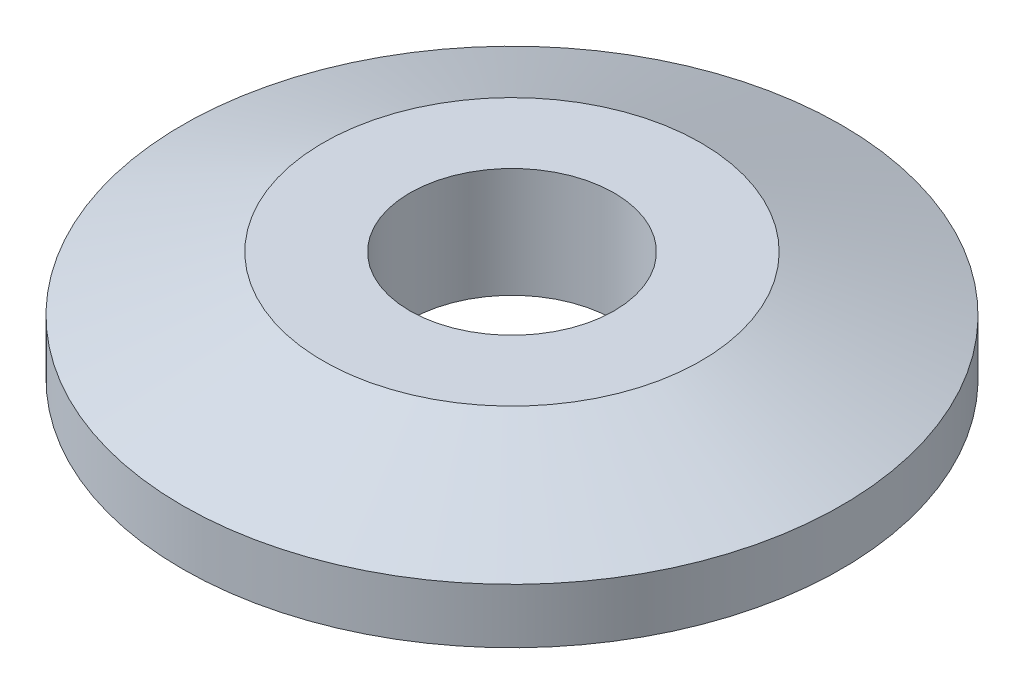
from build123d import *

# Parameters (mm, degrees)
SKETCH1_R           = 15
BOSS_EXTRUDE1_DEPTH = 5
SKETCH2_R           = 8.6
CUT_EXTRUDE1_DEPTH  = 2.5
SKETCH5_R           = 4.65
CUT_EXTRUDE2_DEPTH  = 2.5
CUT_EXTRUDE3_DEPTH  = 1
SKETCH7_R           = 6
SKETCH7_R_2         = 4.65
BOSS_EXTRUDE2_DEPTH = 2.5


with BuildPart() as part:
    # Sketch1 → Boss-Extrude1 (new body)
    with BuildSketch(Plane(origin=(0, 0, 0), x_dir=(1, 0, 0), z_dir=(0, 1, 0))):
        with Locations(Location((0, 0, 0), (0, 0, 270))):
            Circle(SKETCH1_R)
    extrude(amount=BOSS_EXTRUDE1_DEPTH)

    # Sketch2 → Cut-Extrude1 (cut)
    with BuildSketch(Plane.XZ):
        with Locations(Location((0, 0, 0), (0, 0, 270))):
            Circle(SKETCH2_R)
    extrude(amount=-CUT_EXTRUDE1_DEPTH, mode=Mode.SUBTRACT)

    # Sketch4 → Cut-Revolve1 (revolve, cut)
    with BuildSketch(Plane.XY, mode=Mode.PRIVATE) as cut_revolve1_sk:
        Polygon((8.6, 5), (15, 5), (15, 2.5), align=None)
    revolve(cut_revolve1_sk.sketch.rotate(Axis((0, 2.5, 0), (0, 1, 0)), 90), axis=Axis((0, 2.5, 0), (0, 1, 0)), mode=Mode.SUBTRACT)

    # Sketch5 → Cut-Extrude2 (cut)
    with BuildSketch(Plane(origin=(0, 5, 0), x_dir=(1, 0, 0), z_dir=(0, 1, 0))):
        with Locations(Location((0, 0, 0), (0, 0, 270))):
            Circle(SKETCH5_R)
    extrude(amount=-CUT_EXTRUDE2_DEPTH, mode=Mode.SUBTRACT)

    # Sketch6 → Cut-Extrude3 (cut)
    with BuildSketch(Plane.XZ.offset(-2.5)):
        with BuildLine():
            ThreePointArc((-0.757021, -7.461697), (7.461697, -0.757021), (0.757021, 7.461697))
            ThreePointArc((0.757021, 7.461697), (-7.461697, 0.757021), (-0.757021, -7.461697))
        make_face()
        with BuildLine():
            ThreePointArc((0.605617, 5.969357), (-5.969357, 0.605617), (-0.605617, -5.969357))
            ThreePointArc((-0.605617, -5.969357), (5.969357, -0.605617), (0.605617, 5.969357))
        make_face(mode=Mode.SUBTRACT)
    extrude(amount=-CUT_EXTRUDE3_DEPTH, mode=Mode.SUBTRACT)

    # Sketch7 → Boss-Extrude2 (add)
    with BuildSketch(Plane.XZ.offset(-2.5)):
        with Locations(Location((0, 0, 0), (0, 0, 270))):
            Circle(SKETCH7_R)
        with Locations(Location((0, 0, 0), (0, 0, 90))):
            Circle(SKETCH7_R_2, mode=Mode.SUBTRACT)
    extrude(amount=BOSS_EXTRUDE2_DEPTH)


solid = part.part
